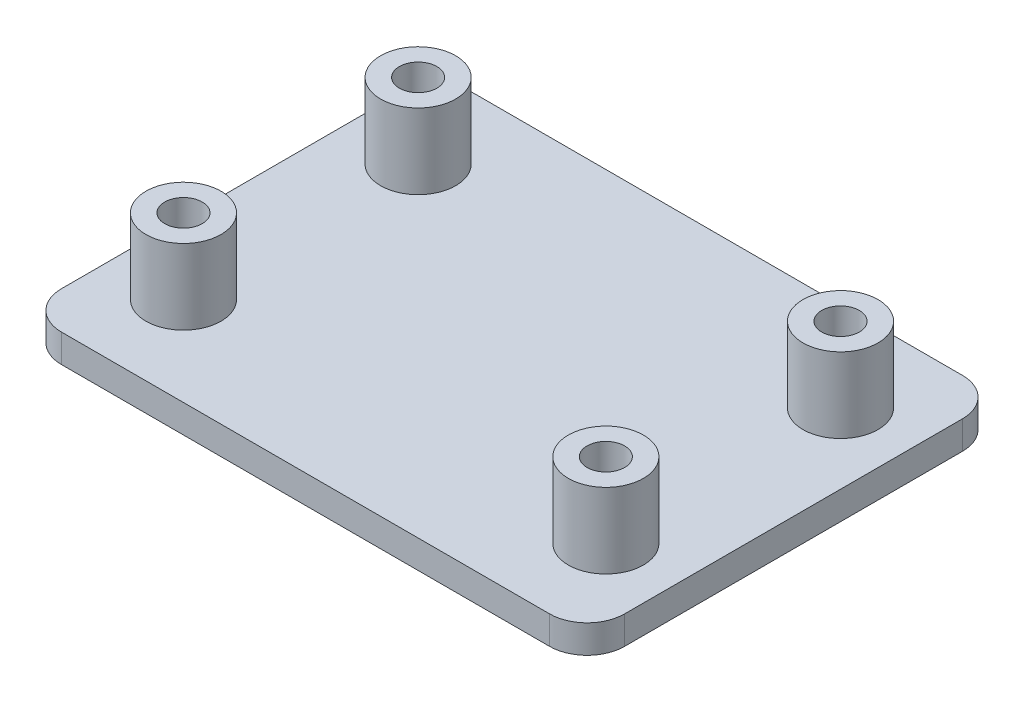
from build123d import *

# Parameters (mm, degrees)
BOSS_EXTRUDE1_DEPTH = 3
SKETCH2_R           = 4
BOSS_EXTRUDE2_DEPTH = 8
SKETCH3_R           = 2
CUT_EXTRUDE1_DEPTH  = 7


with BuildPart() as part:
    # Sketch1 → Boss-Extrude1 (new body)
    with BuildSketch(Plane(origin=(0, 0, 0), x_dir=(1, 0, 0), z_dir=(0, 1, 0))):
        with BuildLine():
            Line((-26, -22), (26, -22))
            ThreePointArc((26, -22), (28.828427125, -20.828427125), (30, -18))
            Line((30, -18), (30, 18))
            ThreePointArc((30, 18), (28.828427125, 20.828427125), (26, 22))
            Line((26, 22), (-26, 22))
            ThreePointArc((-26, 22), (-28.828427125, 20.828427125), (-30, 18))
            Line((-30, 18), (-30, -18))
            ThreePointArc((-30, -18), (-28.828427125, -20.828427125), (-26, -22))
        make_face()
    extrude(amount=BOSS_EXTRUDE1_DEPTH)

    # Sketch2 → Boss-Extrude2 (add)
    with BuildSketch(Plane(origin=(0, 3, 0), x_dir=(1, 0, 0), z_dir=(0, 1, 0))):
        with Locations(Location((22.5, -12.5, 0), (0, 0, 270))):
            Circle(SKETCH2_R)
        with Locations(Location((22.5, 12.5, 0), (0, 0, 270))):
            Circle(SKETCH2_R)
        with Locations(Location((-22.5, -12.5, 0), (0, 0, 270))):
            Circle(SKETCH2_R)
        with Locations(Location((-22.5, 12.5, 0), (0, 0, 270))):
            Circle(SKETCH2_R)
    extrude(amount=BOSS_EXTRUDE2_DEPTH)

    # Sketch3 → Cut-Extrude1 (cut)
    with BuildSketch(Plane(origin=(0, 11, 0), x_dir=(1, 0, 0), z_dir=(0, 1, 0))):
        with Locations(Location((22.5, -12.5, 0), (0, 0, 270))):
            Circle(SKETCH3_R)
        with Locations(Location((22.5, 12.5, 0), (0, 0, 270))):
            Circle(SKETCH3_R)
        with Locations(Location((-22.5, -12.5, 0), (0, 0, 270))):
            Circle(SKETCH3_R)
        with Locations(Location((-22.5, 12.5, 0), (0, 0, 270))):
            Circle(SKETCH3_R)
    extrude(amount=-CUT_EXTRUDE1_DEPTH, mode=Mode.SUBTRACT)


solid = part.part
